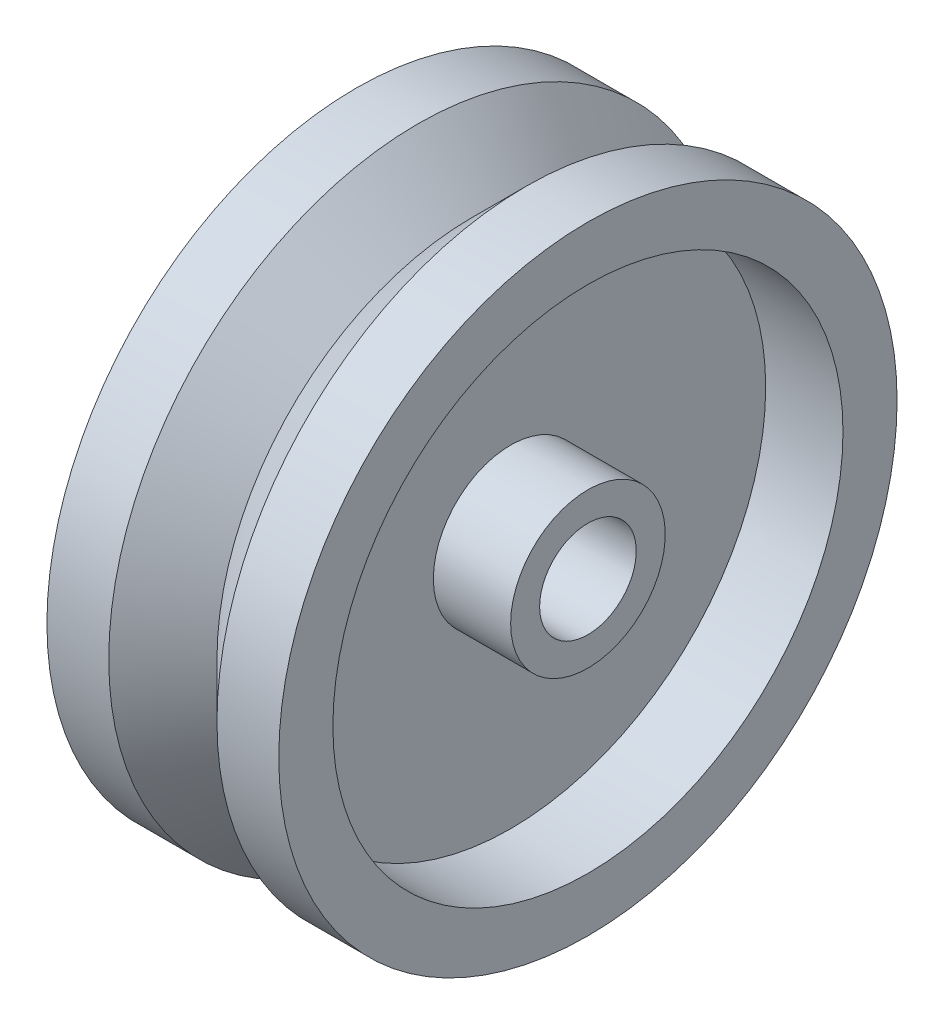
from build123d import *


with BuildPart() as part:
    # Sketch1 → Revolve1 (revolve)
    with BuildSketch(Plane.XY, mode=Mode.PRIVATE) as revolve1_sk:
        Polygon((-7.5, 20), (-3.5, 20), (0, 16.5), (3.5, 20), (7.5, 20), (7.5, 16.5), (2.5, 16.5), (2.5, 5), (7.5, 5), (7.5, 3.125), (-7.5, 3.125), (-7.5, 5), (-2.5, 5), (-2.5, 16.5), (-7.5, 16.5), align=None)
    revolve(revolve1_sk.sketch.rotate(Axis((0, 0, 0), (1, 0, 0)), 90), axis=Axis((0, 0, 0), (1, 0, 0)))


solid = part.part
